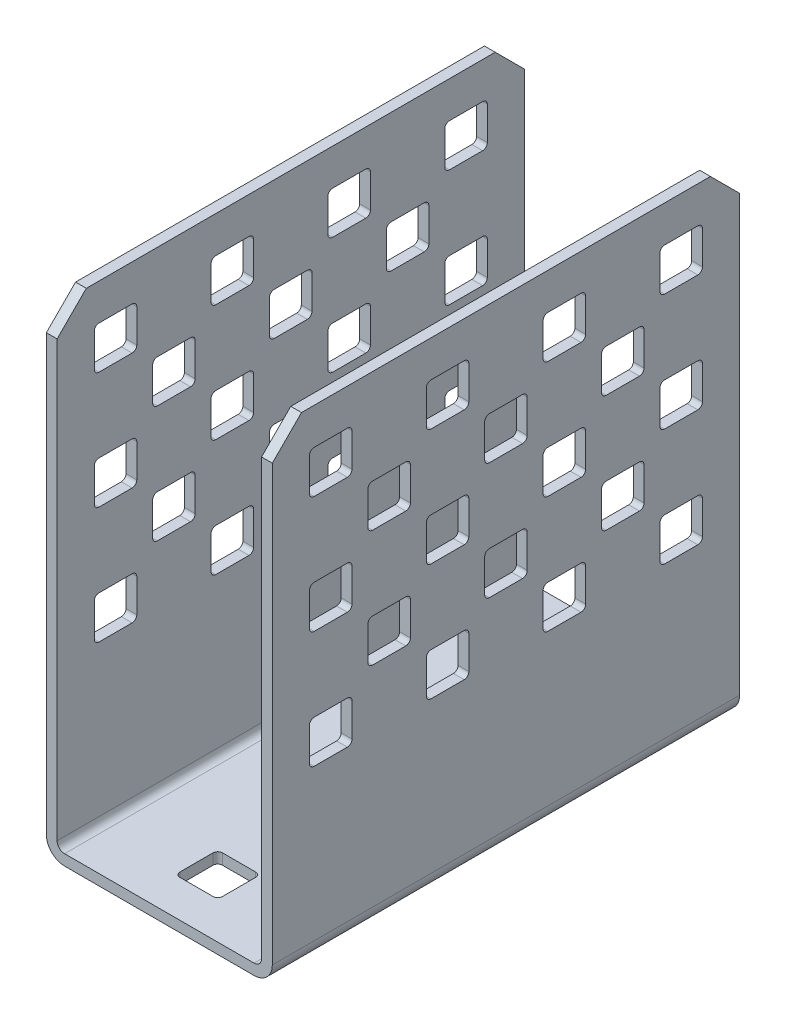
from build123d import *

# Parameters (mm, degrees)
SKETCH1_W           = 50.8
SKETCH1_H           = 52.4002
BOSS_EXTRUDE1_DEPTH = 24.5618
SKETCH2_W           = 22.225
SKETCH2_H           = 51.2318
CUT_EXTRUDE1_DEPTH  = 75.008387801
CUT_EXTRUDE2_REACH  = 65.2
SKETCH3_W           = 4.6228
SKETCH3_H           = 4.6228
CUT_EXTRUDE3_REACH  = 65.2
SKETCH4_W           = 4.6228
SKETCH4_H           = 4.6228
CUT_EXTRUDE4_REACH  = 65.2
SKETCH5_W           = 4.6228
SKETCH5_H           = 4.6228
CUT_EXTRUDE5_REACH  = 65.2
SKETCH6_W           = 4.6228
SKETCH6_H           = 4.6228
CUT_EXTRUDE6_REACH  = 65.2
SKETCH7_W           = 4.6228
SKETCH7_H           = 4.6228
CUT_EXTRUDE7_REACH  = 65.2
SKETCH8_W           = 4.6228
SKETCH8_H           = 4.6228
CUT_EXTRUDE8_REACH  = 65.2
SKETCH9_W           = 4.6228
SKETCH9_H           = 4.6228
CUT_EXTRUDE9_REACH  = 65.2
SKETCH10_W          = 4.6228
SKETCH10_H          = 4.6228
CUT_EXTRUDE10_REACH = 65.2
SKETCH11_W          = 4.6228
SKETCH11_H          = 4.6228
CUT_EXTRUDE11_REACH = 65.2
SKETCH12_W          = 4.6228
SKETCH12_H          = 4.6228
CUT_EXTRUDE12_REACH = 65.2
SKETCH13_W          = 4.6228
SKETCH13_H          = 4.6228
CUT_EXTRUDE13_REACH = 65.2
SKETCH14_W          = 4.6228
SKETCH14_H          = 4.6228
CUT_EXTRUDE14_REACH = 65.2
SKETCH15_W          = 4.6228
SKETCH15_H          = 4.6228
CUT_EXTRUDE15_REACH = 65.2
SKETCH16_W          = 4.6228
SKETCH16_H          = 4.6228
CUT_EXTRUDE16_REACH = 65.2
SKETCH17_W          = 4.6228
SKETCH17_H          = 4.6228
CUT_EXTRUDE17_REACH = 65.2
SKETCH18_W          = 4.6228
SKETCH18_H          = 4.6228
CUT_EXTRUDE18_REACH = 65.2
SKETCH19_W          = 4.6228
SKETCH19_H          = 4.6228
SKETCH20_W          = 4.6228
SKETCH20_H          = 4.6228
CUT_EXTRUDE19_DEPTH = 59.486561158
SKETCH21_W          = 4.6228
SKETCH21_H          = 4.6228
CUT_EXTRUDE20_DEPTH = 59.486561158
SKETCH22_W          = 4.6228
SKETCH22_H          = 4.6228
CUT_EXTRUDE21_DEPTH = 59.486561158
SKETCH23_W          = 4.6228
SKETCH23_H          = 4.6228
CUT_EXTRUDE22_DEPTH = 63.755016721
SKETCH24_W          = 4.6228
SKETCH24_H          = 4.6228
CUT_EXTRUDE23_DEPTH = 63.755016721
SKETCH25_W          = 4.6228
SKETCH25_H          = 4.6228
CUT_EXTRUDE24_DEPTH = 63.755016721
SKETCH26_W          = 4.6228
SKETCH26_H          = 4.6228
CUT_EXTRUDE25_DEPTH = 63.755016721
SKETCH27_W          = 4.6228
SKETCH27_H          = 4.6228
CUT_EXTRUDE26_DEPTH = 63.755016721
SKETCH28_W          = 4.6228
SKETCH28_H          = 4.6228
CUT_EXTRUDE27_DEPTH = 63.755016721
SKETCH29_W          = 4.6228
SKETCH29_H          = 4.6228
CUT_EXTRUDE28_DEPTH = 63.755016721
SKETCH30_W          = 4.6228
SKETCH30_H          = 4.6228
CUT_EXTRUDE29_DEPTH = 63.755016721
SKETCH31_W          = 4.6228
SKETCH31_H          = 4.6228
CUT_EXTRUDE30_DEPTH = 63.755016721
SKETCH32_W          = 4.6228
SKETCH32_H          = 4.6228
CUT_EXTRUDE31_DEPTH = 63.755016721
SKETCH33_W          = 4.6228
SKETCH33_H          = 4.6228
CUT_EXTRUDE32_DEPTH = 63.755016721
SKETCH34_W          = 4.6228
SKETCH34_H          = 4.6228
CUT_EXTRUDE33_DEPTH = 63.755016721
SKETCH35_W          = 4.6228
SKETCH35_H          = 4.6228
CUT_EXTRUDE34_DEPTH = 63.755016721
SKETCH36_W          = 4.6228
SKETCH36_H          = 4.6228
CUT_EXTRUDE35_DEPTH = 63.755016721
SKETCH37_W          = 4.6228
SKETCH37_H          = 4.6228
CUT_EXTRUDE36_DEPTH = 63.755016721
SKETCH38_W          = 4.6228
SKETCH38_H          = 4.6228
CUT_EXTRUDE37_DEPTH = 63.755016721
SKETCH39_W          = 4.6228
SKETCH39_H          = 4.6228
CUT_EXTRUDE38_DEPTH = 63.755016721
SKETCH40_W          = 4.6228
SKETCH40_H          = 4.6228
CUT_EXTRUDE39_DEPTH = 63.755016721
SKETCH41_W          = 4.6228
SKETCH41_H          = 4.6228
CUT_EXTRUDE40_DEPTH = 59.486561158
SKETCH42_W          = 4.6228
SKETCH42_H          = 4.6228
CUT_EXTRUDE41_DEPTH = 63.755016721
CHAMFER1_SIZE       = 3.175
FILLET1_R           = 0.508
FILLET2_R           = 0.8128
FILLET3_R           = 1.9812


with BuildPart() as part:
    # Sketch1 → Boss-Extrude1 (new body)
    with BuildSketch(Plane(origin=(12.2809, 0, 0), x_dir=(0, 0, -1), z_dir=(1, 0, 0))):
        with Locations((0, 26.2001)):
            Rectangle(SKETCH1_W, SKETCH1_H)
    extrude(amount=-BOSS_EXTRUDE1_DEPTH)

    # Sketch2 → Cut-Extrude1 (cut, through all)
    with BuildSketch(Plane(origin=(0, 0, -25.4), x_dir=(-1, 0, 0), z_dir=(0, 0, -1))):
        with Locations((0, 26.7843)):
            Rectangle(SKETCH2_W, SKETCH2_H)
    extrude(amount=-CUT_EXTRUDE1_DEPTH, mode=Mode.SUBTRACT)

    # Sketch3 → Cut-Extrude2 (cut, up to next)
    with BuildSketch(Plane.ZY.offset(12.2809), mode=Mode.PRIVATE) as cut_extrude2_sk1:
        with Locations((-19.05, 20.7264)):
            Rectangle(SKETCH3_W, SKETCH3_H)
    cut_extrude2_tool1 = extrude(cut_extrude2_sk1.sketch, amount=-CUT_EXTRUDE2_REACH, mode=Mode.PRIVATE) & part.part
    add(cut_extrude2_tool1.solids().sort_by_distance((-12.2809, 20.7264, -19.05))[0], mode=Mode.SUBTRACT)

    # Sketch4 → Cut-Extrude3 (cut, up to next)
    with BuildSketch(Plane.ZY.offset(12.2809), mode=Mode.PRIVATE) as cut_extrude3_sk1:
        with Locations((6.35, 20.7264)):
            Rectangle(SKETCH4_W, SKETCH4_H)
    cut_extrude3_tool1 = extrude(cut_extrude3_sk1.sketch, amount=-CUT_EXTRUDE3_REACH, mode=Mode.PRIVATE) & part.part
    add(cut_extrude3_tool1.solids().sort_by_distance((-12.2809, 20.7264, 6.35))[0], mode=Mode.SUBTRACT)

    # Sketch5 → Cut-Extrude4 (cut, up to next)
    with BuildSketch(Plane.ZY.offset(12.2809), mode=Mode.PRIVATE) as cut_extrude4_sk1:
        with Locations((-12.7, 27.0764)):
            Rectangle(SKETCH5_W, SKETCH5_H)
    cut_extrude4_tool1 = extrude(cut_extrude4_sk1.sketch, amount=-CUT_EXTRUDE4_REACH, mode=Mode.PRIVATE) & part.part
    add(cut_extrude4_tool1.solids().sort_by_distance((-12.2809, 27.0764, -12.7))[0], mode=Mode.SUBTRACT)

    # Sketch6 → Cut-Extrude5 (cut, up to next)
    with BuildSketch(Plane.ZY.offset(12.2809), mode=Mode.PRIVATE) as cut_extrude5_sk1:
        with Locations((12.7, 27.0764)):
            Rectangle(SKETCH6_W, SKETCH6_H)
    cut_extrude5_tool1 = extrude(cut_extrude5_sk1.sketch, amount=-CUT_EXTRUDE5_REACH, mode=Mode.PRIVATE) & part.part
    add(cut_extrude5_tool1.solids().sort_by_distance((-12.2809, 27.0764, 12.7))[0], mode=Mode.SUBTRACT)

    # Sketch7 → Cut-Extrude6 (cut, up to next)
    with BuildSketch(Plane.ZY.offset(12.2809), mode=Mode.PRIVATE) as cut_extrude6_sk1:
        with Locations((19.05, 46.1264)):
            Rectangle(SKETCH7_W, SKETCH7_H)
    cut_extrude6_tool1 = extrude(cut_extrude6_sk1.sketch, amount=-CUT_EXTRUDE6_REACH, mode=Mode.PRIVATE) & part.part
    add(cut_extrude6_tool1.solids().sort_by_distance((-12.2809, 46.1264, 19.05))[0], mode=Mode.SUBTRACT)

    # Sketch8 → Cut-Extrude7 (cut, up to next)
    with BuildSketch(Plane.ZY.offset(12.2809), mode=Mode.PRIVATE) as cut_extrude7_sk1:
        with Locations((19.05, 33.4264)):
            Rectangle(SKETCH8_W, SKETCH8_H)
    cut_extrude7_tool1 = extrude(cut_extrude7_sk1.sketch, amount=-CUT_EXTRUDE7_REACH, mode=Mode.PRIVATE) & part.part
    add(cut_extrude7_tool1.solids().sort_by_distance((-12.2809, 33.4264, 19.05))[0], mode=Mode.SUBTRACT)

    # Sketch9 → Cut-Extrude8 (cut, up to next)
    with BuildSketch(Plane.ZY.offset(12.2809), mode=Mode.PRIVATE) as cut_extrude8_sk1:
        with Locations((12.7, 39.7764)):
            Rectangle(SKETCH9_W, SKETCH9_H)
    cut_extrude8_tool1 = extrude(cut_extrude8_sk1.sketch, amount=-CUT_EXTRUDE8_REACH, mode=Mode.PRIVATE) & part.part
    add(cut_extrude8_tool1.solids().sort_by_distance((-12.2809, 39.7764, 12.7))[0], mode=Mode.SUBTRACT)

    # Sketch10 → Cut-Extrude9 (cut, up to next)
    with BuildSketch(Plane.ZY.offset(12.2809), mode=Mode.PRIVATE) as cut_extrude9_sk1:
        with Locations((6.35, 33.4264)):
            Rectangle(SKETCH10_W, SKETCH10_H)
    cut_extrude9_tool1 = extrude(cut_extrude9_sk1.sketch, amount=-CUT_EXTRUDE9_REACH, mode=Mode.PRIVATE) & part.part
    add(cut_extrude9_tool1.solids().sort_by_distance((-12.2809, 33.4264, 6.35))[0], mode=Mode.SUBTRACT)

    # Sketch11 → Cut-Extrude10 (cut, up to next)
    with BuildSketch(Plane.ZY.offset(12.2809), mode=Mode.PRIVATE) as cut_extrude10_sk1:
        with Locations((6.35, 46.1264)):
            Rectangle(SKETCH11_W, SKETCH11_H)
    cut_extrude10_tool1 = extrude(cut_extrude10_sk1.sketch, amount=-CUT_EXTRUDE10_REACH, mode=Mode.PRIVATE) & part.part
    add(cut_extrude10_tool1.solids().sort_by_distance((-12.2809, 46.1264, 6.35))[0], mode=Mode.SUBTRACT)

    # Sketch12 → Cut-Extrude11 (cut, up to next)
    with BuildSketch(Plane.ZY.offset(12.2809), mode=Mode.PRIVATE) as cut_extrude11_sk1:
        with Locations((0, 39.7764)):
            Rectangle(SKETCH12_W, SKETCH12_H)
    cut_extrude11_tool1 = extrude(cut_extrude11_sk1.sketch, amount=-CUT_EXTRUDE11_REACH, mode=Mode.PRIVATE) & part.part
    add(cut_extrude11_tool1.solids().sort_by_distance((-12.2809, 39.7764, 0))[0], mode=Mode.SUBTRACT)

    # Sketch13 → Cut-Extrude12 (cut, up to next)
    with BuildSketch(Plane.ZY.offset(12.2809), mode=Mode.PRIVATE) as cut_extrude12_sk1:
        with Locations((-6.35, 33.4264)):
            Rectangle(SKETCH13_W, SKETCH13_H)
    cut_extrude12_tool1 = extrude(cut_extrude12_sk1.sketch, amount=-CUT_EXTRUDE12_REACH, mode=Mode.PRIVATE) & part.part
    add(cut_extrude12_tool1.solids().sort_by_distance((-12.2809, 33.4264, -6.35))[0], mode=Mode.SUBTRACT)

    # Sketch14 → Cut-Extrude13 (cut, up to next)
    with BuildSketch(Plane.ZY.offset(12.2809), mode=Mode.PRIVATE) as cut_extrude13_sk1:
        with Locations((-6.35, 46.1264)):
            Rectangle(SKETCH14_W, SKETCH14_H)
    cut_extrude13_tool1 = extrude(cut_extrude13_sk1.sketch, amount=-CUT_EXTRUDE13_REACH, mode=Mode.PRIVATE) & part.part
    add(cut_extrude13_tool1.solids().sort_by_distance((-12.2809, 46.1264, -6.35))[0], mode=Mode.SUBTRACT)

    # Sketch15 → Cut-Extrude14 (cut, up to next)
    with BuildSketch(Plane.ZY.offset(12.2809), mode=Mode.PRIVATE) as cut_extrude14_sk1:
        with Locations((-12.7, 39.7764)):
            Rectangle(SKETCH15_W, SKETCH15_H)
    cut_extrude14_tool1 = extrude(cut_extrude14_sk1.sketch, amount=-CUT_EXTRUDE14_REACH, mode=Mode.PRIVATE) & part.part
    add(cut_extrude14_tool1.solids().sort_by_distance((-12.2809, 39.7764, -12.7))[0], mode=Mode.SUBTRACT)

    # Sketch16 → Cut-Extrude15 (cut, up to next)
    with BuildSketch(Plane.ZY.offset(12.2809), mode=Mode.PRIVATE) as cut_extrude15_sk1:
        with Locations((-19.05, 33.4264)):
            Rectangle(SKETCH16_W, SKETCH16_H)
    cut_extrude15_tool1 = extrude(cut_extrude15_sk1.sketch, amount=-CUT_EXTRUDE15_REACH, mode=Mode.PRIVATE) & part.part
    add(cut_extrude15_tool1.solids().sort_by_distance((-12.2809, 33.4264, -19.05))[0], mode=Mode.SUBTRACT)

    # Sketch17 → Cut-Extrude16 (cut, up to next)
    with BuildSketch(Plane.ZY.offset(12.2809), mode=Mode.PRIVATE) as cut_extrude16_sk1:
        with Locations((-19.05, 46.1264)):
            Rectangle(SKETCH17_W, SKETCH17_H)
    cut_extrude16_tool1 = extrude(cut_extrude16_sk1.sketch, amount=-CUT_EXTRUDE16_REACH, mode=Mode.PRIVATE) & part.part
    add(cut_extrude16_tool1.solids().sort_by_distance((-12.2809, 46.1264, -19.05))[0], mode=Mode.SUBTRACT)

    # Sketch18 → Cut-Extrude17 (cut, up to next)
    with BuildSketch(Plane.ZY.offset(12.2809), mode=Mode.PRIVATE) as cut_extrude17_sk1:
        with Locations((0, 27.0764)):
            Rectangle(SKETCH18_W, SKETCH18_H)
    cut_extrude17_tool1 = extrude(cut_extrude17_sk1.sketch, amount=-CUT_EXTRUDE17_REACH, mode=Mode.PRIVATE) & part.part
    add(cut_extrude17_tool1.solids().sort_by_distance((-12.2809, 27.0764, 0))[0], mode=Mode.SUBTRACT)

    # Sketch19 → Cut-Extrude18 (cut, up to next)
    with BuildSketch(Plane.ZY.offset(12.2809), mode=Mode.PRIVATE) as cut_extrude18_sk1:
        with Locations((19.05, 20.7264)):
            Rectangle(SKETCH19_W, SKETCH19_H)
    cut_extrude18_tool1 = extrude(cut_extrude18_sk1.sketch, amount=-CUT_EXTRUDE18_REACH, mode=Mode.PRIVATE) & part.part
    add(cut_extrude18_tool1.solids().sort_by_distance((-12.2809, 20.7264, 19.05))[0], mode=Mode.SUBTRACT)

    # Sketch20 → Cut-Extrude19 (cut, through all)
    with BuildSketch(Plane(origin=(0, 1.1684, 0), x_dir=(-1, 0, 0), z_dir=(0, 1, 0))):
        with Locations((0, -19.05)):
            Rectangle(SKETCH20_W, SKETCH20_H)
    extrude(amount=-CUT_EXTRUDE19_DEPTH, mode=Mode.SUBTRACT)

    # Sketch21 → Cut-Extrude20 (cut, through all)
    with BuildSketch(Plane(origin=(0, 1.1684, 0), x_dir=(-1, 0, 0), z_dir=(0, 1, 0))):
        with Locations((0, -6.35)):
            Rectangle(SKETCH21_W, SKETCH21_H)
    extrude(amount=-CUT_EXTRUDE20_DEPTH, mode=Mode.SUBTRACT)

    # Sketch22 → Cut-Extrude21 (cut, through all)
    with BuildSketch(Plane(origin=(0, 1.1684, 0), x_dir=(-1, 0, 0), z_dir=(0, 1, 0))):
        with Locations((0, 19.05)):
            Rectangle(SKETCH22_W, SKETCH22_H)
    extrude(amount=-CUT_EXTRUDE21_DEPTH, mode=Mode.SUBTRACT)

    # Sketch23 → Cut-Extrude22 (cut, through all)
    with BuildSketch(Plane.ZY.offset(-11.1125)):
        with Locations((-19.05, 20.7264)):
            Rectangle(SKETCH23_W, SKETCH23_H)
    extrude(amount=-CUT_EXTRUDE22_DEPTH, mode=Mode.SUBTRACT)

    # Sketch24 → Cut-Extrude23 (cut, through all)
    with BuildSketch(Plane.ZY.offset(-11.1125)):
        with Locations((6.35, 20.7264)):
            Rectangle(SKETCH24_W, SKETCH24_H)
    extrude(amount=-CUT_EXTRUDE23_DEPTH, mode=Mode.SUBTRACT)

    # Sketch25 → Cut-Extrude24 (cut, through all)
    with BuildSketch(Plane.ZY.offset(-11.1125)):
        with Locations((-12.7, 27.0764)):
            Rectangle(SKETCH25_W, SKETCH25_H)
    extrude(amount=-CUT_EXTRUDE24_DEPTH, mode=Mode.SUBTRACT)

    # Sketch26 → Cut-Extrude25 (cut, through all)
    with BuildSketch(Plane.ZY.offset(-11.1125)):
        with Locations((12.7, 27.0764)):
            Rectangle(SKETCH26_W, SKETCH26_H)
    extrude(amount=-CUT_EXTRUDE25_DEPTH, mode=Mode.SUBTRACT)

    # Sketch27 → Cut-Extrude26 (cut, through all)
    with BuildSketch(Plane.ZY.offset(-11.1125)):
        with Locations((19.05, 46.1264)):
            Rectangle(SKETCH27_W, SKETCH27_H)
    extrude(amount=-CUT_EXTRUDE26_DEPTH, mode=Mode.SUBTRACT)

    # Sketch28 → Cut-Extrude27 (cut, through all)
    with BuildSketch(Plane.ZY.offset(-11.1125)):
        with Locations((19.05, 33.4264)):
            Rectangle(SKETCH28_W, SKETCH28_H)
    extrude(amount=-CUT_EXTRUDE27_DEPTH, mode=Mode.SUBTRACT)

    # Sketch29 → Cut-Extrude28 (cut, through all)
    with BuildSketch(Plane.ZY.offset(-11.1125)):
        with Locations((12.7, 39.7764)):
            Rectangle(SKETCH29_W, SKETCH29_H)
    extrude(amount=-CUT_EXTRUDE28_DEPTH, mode=Mode.SUBTRACT)

    # Sketch30 → Cut-Extrude29 (cut, through all)
    with BuildSketch(Plane.ZY.offset(-11.1125)):
        with Locations((6.35, 33.4264)):
            Rectangle(SKETCH30_W, SKETCH30_H)
    extrude(amount=-CUT_EXTRUDE29_DEPTH, mode=Mode.SUBTRACT)

    # Sketch31 → Cut-Extrude30 (cut, through all)
    with BuildSketch(Plane.ZY.offset(-11.1125)):
        with Locations((6.35, 46.1264)):
            Rectangle(SKETCH31_W, SKETCH31_H)
    extrude(amount=-CUT_EXTRUDE30_DEPTH, mode=Mode.SUBTRACT)

    # Sketch32 → Cut-Extrude31 (cut, through all)
    with BuildSketch(Plane.ZY.offset(-11.1125)):
        with Locations((0, 39.7764)):
            Rectangle(SKETCH32_W, SKETCH32_H)
    extrude(amount=-CUT_EXTRUDE31_DEPTH, mode=Mode.SUBTRACT)

    # Sketch33 → Cut-Extrude32 (cut, through all)
    with BuildSketch(Plane.ZY.offset(-11.1125)):
        with Locations((-6.35, 33.4264)):
            Rectangle(SKETCH33_W, SKETCH33_H)
    extrude(amount=-CUT_EXTRUDE32_DEPTH, mode=Mode.SUBTRACT)

    # Sketch34 → Cut-Extrude33 (cut, through all)
    with BuildSketch(Plane.ZY.offset(-11.1125)):
        with Locations((-6.35, 46.1264)):
            Rectangle(SKETCH34_W, SKETCH34_H)
    extrude(amount=-CUT_EXTRUDE33_DEPTH, mode=Mode.SUBTRACT)

    # Sketch35 → Cut-Extrude34 (cut, through all)
    with BuildSketch(Plane.ZY.offset(-11.1125)):
        with Locations((-12.7, 39.7764)):
            Rectangle(SKETCH35_W, SKETCH35_H)
    extrude(amount=-CUT_EXTRUDE34_DEPTH, mode=Mode.SUBTRACT)

    # Sketch36 → Cut-Extrude35 (cut, through all)
    with BuildSketch(Plane.ZY.offset(-11.1125)):
        with Locations((-19.05, 33.4264)):
            Rectangle(SKETCH36_W, SKETCH36_H)
    extrude(amount=-CUT_EXTRUDE35_DEPTH, mode=Mode.SUBTRACT)

    # Sketch37 → Cut-Extrude36 (cut, through all)
    with BuildSketch(Plane.ZY.offset(-11.1125)):
        with Locations((-19.05, 46.1264)):
            Rectangle(SKETCH37_W, SKETCH37_H)
    extrude(amount=-CUT_EXTRUDE36_DEPTH, mode=Mode.SUBTRACT)

    # Sketch38 → Cut-Extrude37 (cut, through all)
    with BuildSketch(Plane.ZY.offset(-11.1125)):
        with Locations((0, 27.0764)):
            Rectangle(SKETCH38_W, SKETCH38_H)
    extrude(amount=-CUT_EXTRUDE37_DEPTH, mode=Mode.SUBTRACT)

    # Sketch39 → Cut-Extrude38 (cut, through all)
    with BuildSketch(Plane.ZY.offset(-11.1125)):
        with Locations((19.05, 20.7264)):
            Rectangle(SKETCH39_W, SKETCH39_H)
    extrude(amount=-CUT_EXTRUDE38_DEPTH, mode=Mode.SUBTRACT)

    # Sketch40 → Cut-Extrude39 (cut, through all)
    with BuildSketch(Plane.ZY.offset(-11.1125)):
        with Locations((-6.35, 20.7264)):
            Rectangle(SKETCH40_W, SKETCH40_H)
    extrude(amount=-CUT_EXTRUDE39_DEPTH, mode=Mode.SUBTRACT)

    # Sketch41 → Cut-Extrude40 (cut, through all)
    with BuildSketch(Plane(origin=(0, 1.1684, 0), x_dir=(-1, 0, 0), z_dir=(0, 1, 0))):
        with Locations((0, 6.35)):
            Rectangle(SKETCH41_W, SKETCH41_H)
    extrude(amount=-CUT_EXTRUDE40_DEPTH, mode=Mode.SUBTRACT)

    # Sketch42 → Cut-Extrude41 (cut, through all)
    with BuildSketch(Plane(origin=(-11.1125, 0, 0), x_dir=(0, 0, -1), z_dir=(1, 0, 0))):
        with Locations((6.35, 20.7264)):
            Rectangle(SKETCH42_W, SKETCH42_H)
    extrude(amount=-CUT_EXTRUDE41_DEPTH, mode=Mode.SUBTRACT)

    # Chamfer1
    chamfer1_edges = [part.edges().sort_by_distance(p)[0] for p in [
        (11.6967, 52.4002, -25.4),
        (11.6967, 52.4002, 25.4),
        (-11.6967, 52.4002, 25.4),
        (-11.6967, 52.4002, -25.4),
    ]]
    chamfer(chamfer1_edges, length=CHAMFER1_SIZE)

    # Fillet1
    fillet1_edges = [part.edges().sort_by_distance(p)[0] for p in [
        (-11.6967, 31.115, 16.7386),
        (-11.6967, 35.7378, 16.7386),
        (-11.6967, 35.7378, 21.3614),
        (-11.6967, 31.115, 21.3614),
        (-11.6967, 42.0878, 10.3886),
        (-11.6967, 42.0878, 15.0114),
        (-11.6967, 37.465, 15.0114),
        (-11.6967, 37.465, 10.3886),
        (-11.6967, 35.7378, 4.0386),
        (-11.6967, 35.7378, 8.6614),
        (-11.6967, 31.115, 8.6614),
        (-11.6967, 31.115, 4.0386),
        (-11.6967, 48.4378, 4.0386),
        (-11.6967, 48.4378, 8.6614),
        (-11.6967, 43.815, 8.6614),
        (-11.6967, 43.815, 4.0386),
        (-11.6967, 42.0878, -2.3114),
        (-11.6967, 42.0878, 2.3114),
        (-11.6967, 37.465, 2.3114),
        (-11.6967, 37.465, -2.3114),
        (-11.6967, 35.7378, -8.6614),
        (-11.6967, 35.7378, -4.0386),
        (-11.6967, 31.115, -4.0386),
        (-11.6967, 31.115, -8.6614),
        (-11.6967, 48.4378, -8.6614),
        (-11.6967, 48.4378, -4.0386),
        (-11.6967, 43.815, -4.0386),
        (-11.6967, 43.815, -8.6614),
        (-11.6967, 42.0878, -15.0114),
        (-11.6967, 42.0878, -10.3886),
        (-11.6967, 37.465, -10.3886),
        (-11.6967, 37.465, -15.0114),
        (-11.6967, 35.7378, -21.3614),
        (-11.6967, 35.7378, -16.7386),
        (-11.6967, 31.115, -16.7386),
        (-11.6967, 31.115, -21.3614),
        (-11.6967, 48.4378, -21.3614),
        (-11.6967, 48.4378, -16.7386),
        (-11.6967, 43.815, -16.7386),
        (-11.6967, 43.815, -21.3614),
        (-11.6967, 24.765, -2.3114),
        (-11.6967, 29.3878, -2.3114),
        (-11.6967, 29.3878, 2.3114),
        (-11.6967, 24.765, 2.3114),
        (-11.6967, 18.415, 16.7386),
        (-11.6967, 23.0378, 16.7386),
        (-11.6967, 23.0378, 21.3614),
        (-11.6967, 18.415, 21.3614),
        (2.3114, 0.5842, -21.3614),
        (2.3114, 0.5842, -16.7386),
        (-2.3114, 0.5842, -16.7386),
        (-2.3114, 0.5842, -21.3614),
        (2.3114, 0.5842, -8.6614),
        (2.3114, 0.5842, -4.0386),
        (-2.3114, 0.5842, -4.0386),
        (-2.3114, 0.5842, -8.6614),
        (2.3114, 0.5842, 16.7386),
        (2.3114, 0.5842, 21.3614),
        (-2.3114, 0.5842, 21.3614),
        (-2.3114, 0.5842, 16.7386),
        (-11.6967, 18.415, -21.3614),
        (-11.6967, 23.0378, -21.3614),
        (-11.6967, 23.0378, -16.7386),
        (-11.6967, 18.415, -16.7386),
        (11.6967, 23.0378, -16.7386),
        (11.6967, 18.415, -16.7386),
        (11.6967, 18.415, -21.3614),
        (11.6967, 23.0378, -21.3614),
        (11.6967, 23.0378, 8.6614),
        (11.6967, 18.415, 8.6614),
        (11.6967, 18.415, 4.0386),
        (11.6967, 23.0378, 4.0386),
        (11.6967, 29.3878, -10.3886),
        (11.6967, 24.765, -10.3886),
        (11.6967, 24.765, -15.0114),
        (11.6967, 29.3878, -15.0114),
        (11.6967, 29.3878, 15.0114),
        (11.6967, 24.765, 15.0114),
        (11.6967, 24.765, 10.3886),
        (11.6967, 29.3878, 10.3886),
        (11.6967, 43.815, 21.3614),
        (11.6967, 43.815, 16.7386),
        (11.6967, 48.4378, 16.7386),
        (11.6967, 48.4378, 21.3614),
        (11.6967, 31.115, 21.3614),
        (11.6967, 31.115, 16.7386),
        (11.6967, 35.7378, 16.7386),
        (11.6967, 35.7378, 21.3614),
        (11.6967, 37.465, 15.0114),
        (11.6967, 37.465, 10.3886),
        (11.6967, 42.0878, 10.3886),
        (11.6967, 42.0878, 15.0114),
        (11.6967, 31.115, 8.6614),
        (11.6967, 31.115, 4.0386),
        (11.6967, 35.7378, 4.0386),
        (11.6967, 35.7378, 8.6614),
        (11.6967, 43.815, 8.6614),
        (-11.6967, 18.415, 4.0386),
        (11.6967, 43.815, 4.0386),
        (11.6967, 48.4378, 4.0386),
        (11.6967, 48.4378, 8.6614),
        (-11.6967, 23.0378, 4.0386),
        (-11.6967, 23.0378, 8.6614),
        (-11.6967, 18.415, 8.6614),
        (11.6967, 37.465, 2.3114),
        (11.6967, 37.465, -2.3114),
        (11.6967, 42.0878, -2.3114),
        (11.6967, 42.0878, 2.3114),
        (11.6967, 31.115, -4.0386),
        (11.6967, 31.115, -8.6614),
        (11.6967, 35.7378, -8.6614),
        (11.6967, 35.7378, -4.0386),
        (11.6967, 43.815, -4.0386),
        (11.6967, 43.815, -8.6614),
        (11.6967, 48.4378, -8.6614),
        (11.6967, 48.4378, -4.0386),
        (11.6967, 37.465, -10.3886),
        (11.6967, 37.465, -15.0114),
        (11.6967, 42.0878, -15.0114),
        (11.6967, 42.0878, -10.3886),
        (11.6967, 31.115, -16.7386),
        (11.6967, 31.115, -21.3614),
        (11.6967, 35.7378, -21.3614),
        (11.6967, 35.7378, -16.7386),
        (11.6967, 43.815, -16.7386),
        (11.6967, 43.815, -21.3614),
        (11.6967, 48.4378, -21.3614),
        (11.6967, 48.4378, -16.7386),
        (11.6967, 29.3878, 2.3114),
        (11.6967, 24.765, 2.3114),
        (11.6967, 24.765, -2.3114),
        (11.6967, 29.3878, -2.3114),
        (11.6967, 23.0378, 21.3614),
        (11.6967, 18.415, 21.3614),
        (11.6967, 18.415, 16.7386),
        (11.6967, 23.0378, 16.7386),
        (11.6967, 23.0378, -4.0386),
        (11.6967, 18.415, -4.0386),
        (11.6967, 18.415, -8.6614),
        (11.6967, 23.0378, -8.6614),
        (-11.6967, 24.765, -15.0114),
        (-11.6967, 29.3878, -15.0114),
        (-11.6967, 29.3878, -10.3886),
        (-11.6967, 24.765, -10.3886),
        (2.3114, 0.5842, 4.0386),
        (2.3114, 0.5842, 8.6614),
        (-2.3114, 0.5842, 8.6614),
        (-2.3114, 0.5842, 4.0386),
        (-11.6967, 23.0378, -4.0386),
        (-11.6967, 23.0378, -8.6614),
        (-11.6967, 18.415, -8.6614),
        (-11.6967, 18.415, -4.0386),
        (-11.6967, 24.765, 10.3886),
        (-11.6967, 29.3878, 10.3886),
        (-11.6967, 29.3878, 15.0114),
        (-11.6967, 24.765, 15.0114),
        (-11.6967, 43.815, 16.7386),
        (-11.6967, 48.4378, 16.7386),
        (-11.6967, 48.4378, 21.3614),
        (-11.6967, 43.815, 21.3614),
    ]]
    fillet(fillet1_edges, radius=FILLET1_R)

    # Fillet2
    fillet2_edges = [part.edges().sort_by_distance(p)[0] for p in [
        (-11.1125, 1.1684, 0),
        (11.1125, 1.1684, 0),
    ]]
    fillet(fillet2_edges, radius=FILLET2_R)

    # Fillet3
    fillet3_edges = [part.edges().sort_by_distance(p)[0] for p in [
        (-12.2809, 0, 0),
        (12.2809, 0, 0),
    ]]
    fillet(fillet3_edges, radius=FILLET3_R)


solid = part.part
